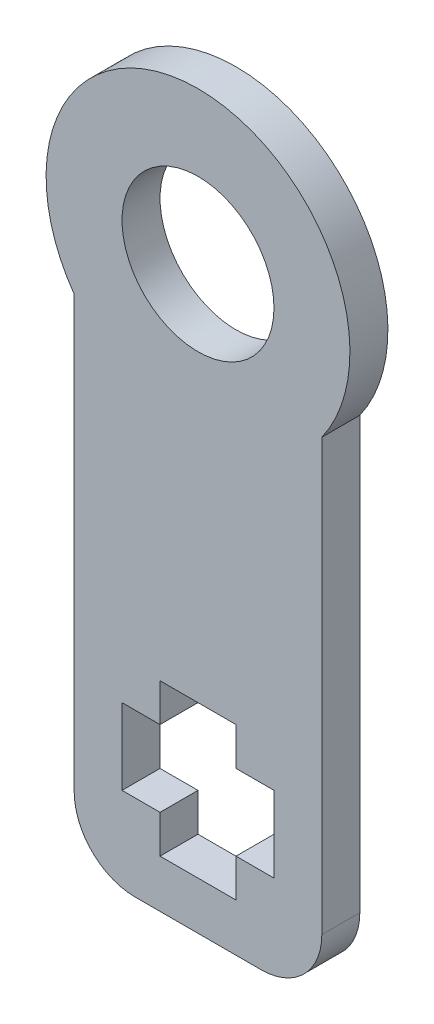
from build123d import *

# Parameters (mm, degrees)
BOSS_EXTRUDE1_DEPTH = 1.5875
FILLET1_R           = 2.54
SKETCH2_R           = 3.175
CUT_EXTRUDE1_DEPTH  = 27.229804731


with BuildPart() as part:
    # Sketch1 → Boss-Extrude1 (new body)
    with BuildSketch(Plane.XY):
        with BuildLine():
            Line((-5.175, 15.370071332), (-5.175, -5.175))
            Line((-5.175, -5.175), (5.175, -5.175))
            Line((5.175, -5.175), (5.175, 15.370071332))
            ThreePointArc((5.175, 15.370071332), (0, 25.4), (-5.175, 15.370071332))
        make_face()
        Polygon((-3.175, -1.5875), (-3.175, 1.5875), (-1.5875, 1.5875), (-1.5875, 3.175), (1.5875, 3.175), (1.5875, 1.5875), (3.175, 1.5875), (3.175, -1.5875), (1.5875, -1.5875), (1.5875, -3.175), (-1.5875, -3.175), (-1.5875, -1.5875), align=None, mode=Mode.SUBTRACT)
    extrude(amount=BOSS_EXTRUDE1_DEPTH)

    # Fillet1
    fillet1_edges = [part.edges().sort_by_distance(p)[0] for p in [
        (5.175, -5.175, 0.79375),
        (-5.175, -5.175, 0.79375),
    ]]
    fillet(fillet1_edges, radius=FILLET1_R)

    # Sketch2 → Cut-Extrude1 (cut, through all)
    with BuildSketch(Plane.XY.offset(1.5875)):
        with Locations((0, 19.05)):
            Circle(SKETCH2_R)
    extrude(amount=-CUT_EXTRUDE1_DEPTH, mode=Mode.SUBTRACT)


solid = part.part
